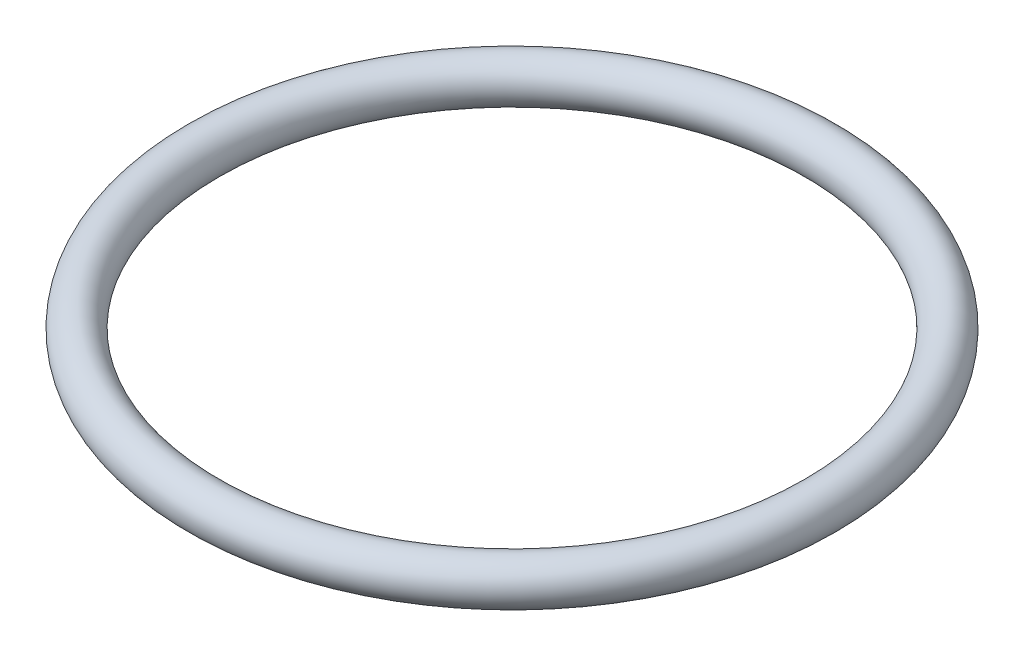
from build123d import *

# Parameters (mm, degrees)
SKETCH2_R = 25.4


with BuildPart() as part:
    # Sweep1: sweep along a path in Sketch1
    with BuildLine(Plane(origin=(0, 0, 0), x_dir=(1, 0, 0), z_dir=(0, 1, 0))) as sweep1_path:
        CenterArc((0, 0), 361.95, 0, 360)
    # Sketch2 → Sweep1 (sweep)
    with BuildSketch(Plane.XY):
        with Locations((-361.95, 0)):
            Circle(SKETCH2_R)
    sweep(path=sweep1_path.line)


solid = part.part
